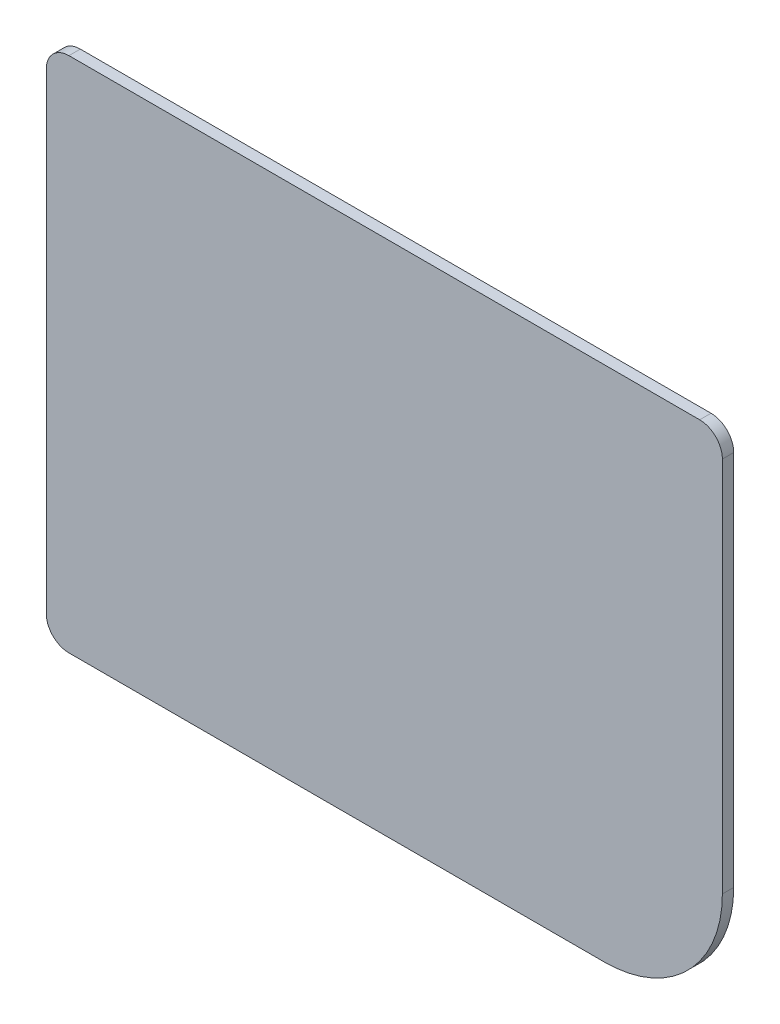
from build123d import *

# Parameters (mm, degrees)
BOSS_EXTRUDE1_DEPTH = 1.25


with BuildPart() as part:
    # Sketch1 → Boss-Extrude1 (new body)
    with BuildSketch(Plane.XY):
        with BuildLine():
            Line((-34.75, -28.5), (24.25, -28.5))
            ThreePointArc((24.25, -28.5), (33.442388155, -24.692388155), (37.25, -15.5))
            Line((37.25, -15.5), (37.25, 26))
            ThreePointArc((37.25, 26), (36.517766953, 27.767766953), (34.75, 28.5))
            Line((34.75, 28.5), (-34.75, 28.5))
            ThreePointArc((-34.75, 28.5), (-36.517766953, 27.767766953), (-37.25, 26))
            Line((-37.25, 26), (-37.25, -26))
            ThreePointArc((-37.25, -26), (-36.517766953, -27.767766953), (-34.75, -28.5))
        make_face()
    extrude(amount=BOSS_EXTRUDE1_DEPTH)


solid = part.part
